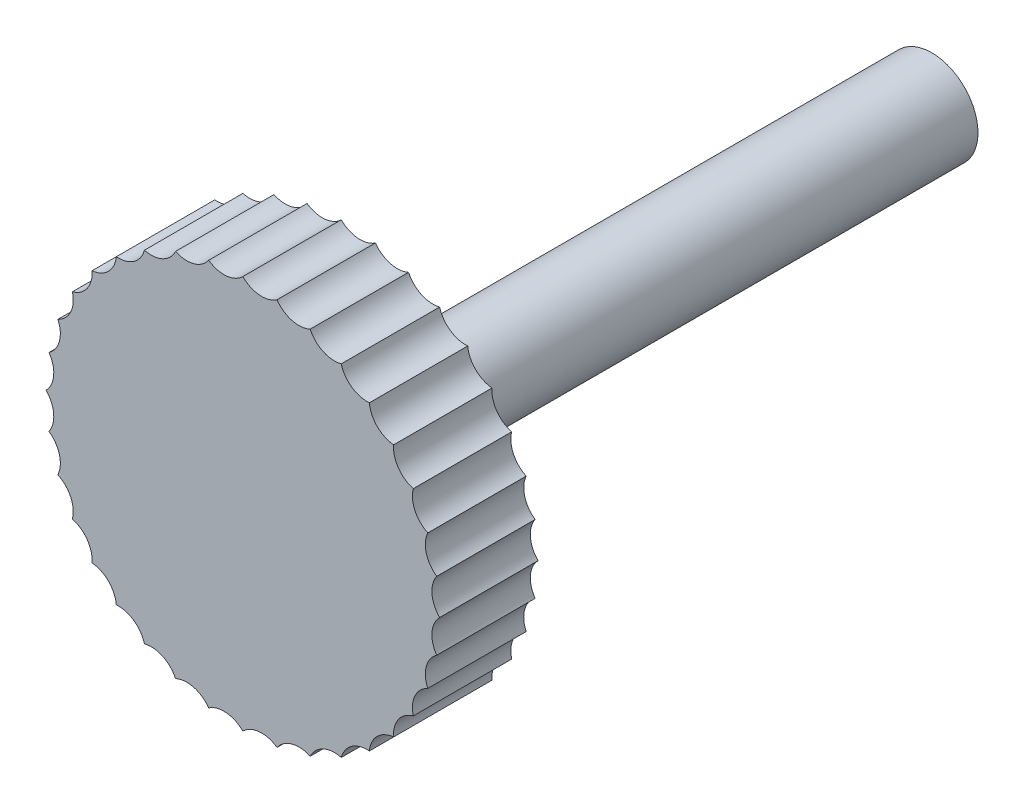
from build123d import *

# Parameters (mm, degrees)
SKIZZE1_R                       = 2.35
AUFSATZ_LINEAR_AUSTRAGEN1_DEPTH = 30
SKIZZE4_R                       = 1.55
SCHNITT_LINEAR_AUSTRAGEN2_DEPTH = 6
SKIZZE5_R                       = 10
AUFSATZ_LINEAR_AUSTRAGEN3_DEPTH = 5
SCHNITT_LINEAR_START            = -5
SKIZZE6_R                       = 12.190209649
SCHNITT_LINEAR_AUSTRAGEN3_DEPTH = 5


with BuildPart() as part:
    # Skizze1 → Aufsatz-Linear austragen1 (new body)
    with BuildSketch(Plane.XY):
        Circle(SKIZZE1_R)
    extrude(amount=AUFSATZ_LINEAR_AUSTRAGEN1_DEPTH)

    # Skizze4 → Schnitt-Linear austragen2 (cut)
    with BuildSketch(Plane(origin=(0, 0, 0), x_dir=(-1, 0, 0), z_dir=(0, 0, -1))):
        Circle(SKIZZE4_R)
    extrude(amount=-SCHNITT_LINEAR_AUSTRAGEN2_DEPTH, mode=Mode.SUBTRACT)

    # Skizze5 → Aufsatz-Linear austragen3 (add)
    with BuildSketch(Plane.XY.offset(30)):
        Circle(SKIZZE5_R)
    extrude(amount=AUFSATZ_LINEAR_AUSTRAGEN3_DEPTH)

    # Skizze6 → Schnitt-Linear austragen3 (cut)
    with BuildSketch(Plane.XY.offset(35).offset(SCHNITT_LINEAR_START)):
        Circle(SKIZZE6_R)
        with BuildLine():
            ThreePointArc((0, 10), (0.840722593, 9.609503215), (1.736481777, 9.84807753))
            ThreePointArc((1.736481777, 9.84807753), (2.49662285, 9.317523323), (3.420201433, 9.396926208))
            ThreePointArc((3.420201433, 9.396926208), (4.076664484, 8.742435199), (5, 8.660254038))
            ThreePointArc((5, 8.660254038), (5.532838731, 7.901712605), (6.427876097, 7.660444431))
            ThreePointArc((6.427876097, 7.660444431), (6.820900473, 6.820900473), (7.660444431, 6.427876097))
            ThreePointArc((7.660444431, 6.427876097), (7.901712605, 5.532838731), (8.660254038, 5))
            ThreePointArc((8.660254038, 5), (8.742435199, 4.076664484), (9.396926208, 3.420201433))
            ThreePointArc((9.396926208, 3.420201433), (9.317523323, 2.49662285), (9.84807753, 1.736481777))
            ThreePointArc((9.84807753, 1.736481777), (9.609503215, 0.840722593), (10, 0))
            ThreePointArc((10, 0), (9.609503215, -0.840722593), (9.84807753, -1.736481777))
            ThreePointArc((9.84807753, -1.736481777), (9.317523323, -2.49662285), (9.396926208, -3.420201433))
            ThreePointArc((9.396926208, -3.420201433), (8.742435199, -4.076664484), (8.660254038, -5))
            ThreePointArc((8.660254038, -5), (7.901712605, -5.532838731), (7.660444431, -6.427876097))
            ThreePointArc((7.660444431, -6.427876097), (6.820900473, -6.820900473), (6.427876097, -7.660444431))
            ThreePointArc((6.427876097, -7.660444431), (5.532838731, -7.901712605), (5, -8.660254038))
            ThreePointArc((5, -8.660254038), (4.076664484, -8.742435199), (3.420201433, -9.396926208))
            ThreePointArc((3.420201433, -9.396926208), (2.49662285, -9.317523323), (1.736481777, -9.84807753))
            ThreePointArc((1.736481777, -9.84807753), (0.840722593, -9.609503215), (0, -10))
            ThreePointArc((0, -10), (-0.840722593, -9.609503215), (-1.736481777, -9.84807753))
            ThreePointArc((-1.736481777, -9.84807753), (-2.49662285, -9.317523323), (-3.420201433, -9.396926208))
            ThreePointArc((-3.420201433, -9.396926208), (-4.076664484, -8.742435199), (-5, -8.660254038))
            ThreePointArc((-5, -8.660254038), (-5.532838731, -7.901712605), (-6.427876097, -7.660444431))
            ThreePointArc((-6.427876097, -7.660444431), (-6.820900473, -6.820900473), (-7.660444431, -6.427876097))
            ThreePointArc((-7.660444431, -6.427876097), (-7.901712605, -5.532838731), (-8.660254038, -5))
            ThreePointArc((-8.660254038, -5), (-8.742435199, -4.076664484), (-9.396926208, -3.420201433))
            ThreePointArc((-9.396926208, -3.420201433), (-9.317523323, -2.49662285), (-9.84807753, -1.736481777))
            ThreePointArc((-9.84807753, -1.736481777), (-9.609503215, -0.840722593), (-10, 0))
            ThreePointArc((-10, 0), (-9.609503215, 0.840722593), (-9.84807753, 1.736481777))
            ThreePointArc((-9.84807753, 1.736481777), (-9.317523323, 2.49662285), (-9.396926208, 3.420201433))
            ThreePointArc((-9.396926208, 3.420201433), (-8.742435199, 4.076664484), (-8.660254038, 5))
            ThreePointArc((-8.660254038, 5), (-7.901712605, 5.532838731), (-7.660444431, 6.427876097))
            ThreePointArc((-7.660444431, 6.427876097), (-6.820900473, 6.820900473), (-6.427876097, 7.660444431))
            ThreePointArc((-6.427876097, 7.660444431), (-5.532838731, 7.901712605), (-5, 8.660254038))
            ThreePointArc((-5, 8.660254038), (-4.076664484, 8.742435199), (-3.420201433, 9.396926208))
            ThreePointArc((-3.420201433, 9.396926208), (-2.49662285, 9.317523323), (-1.736481777, 9.84807753))
            ThreePointArc((-1.736481777, 9.84807753), (-0.840722593, 9.609503215), (0, 10))
        make_face(mode=Mode.SUBTRACT)
    extrude(amount=SCHNITT_LINEAR_AUSTRAGEN3_DEPTH, mode=Mode.SUBTRACT)


solid = part.part
